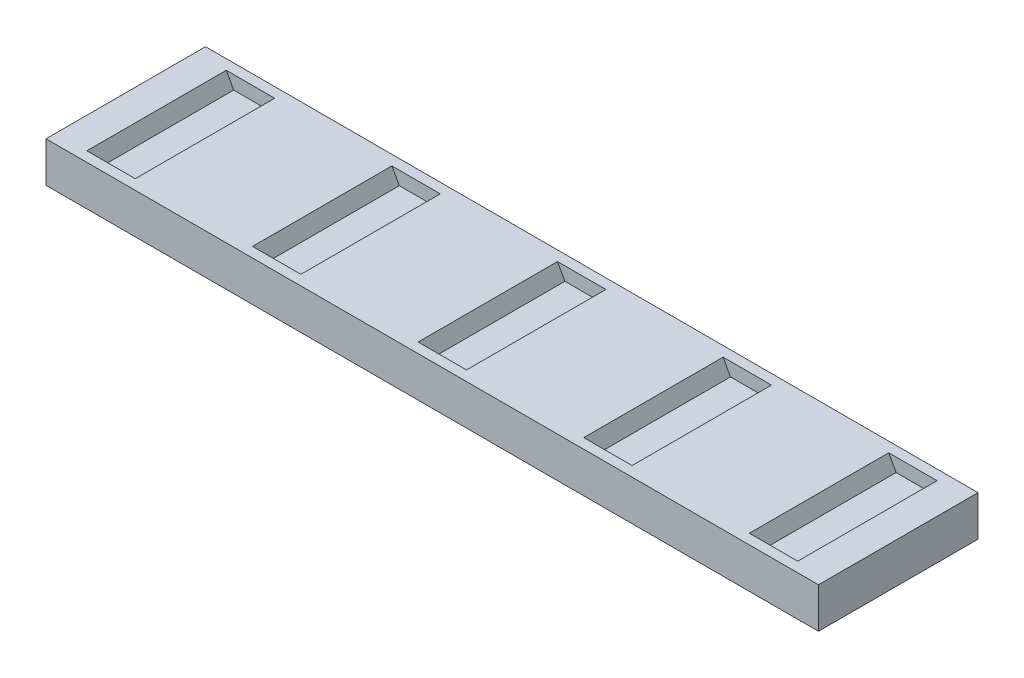
from build123d import *

# Parameters (mm, degrees)
EXTRUDE_1_DEPTH     = 19.2
SKETCH_9_W          = 230
SKETCH_9_H          = 17.5
SKETCH_9_R          = 2.1
EXTRUDE_2_DEPTH     = 3
SKETCH_13_W         = 230
SKETCH_13_H         = 16
SKETCH_13_R         = 2.1
EXTRUDE_3_DEPTH     = 1.55
SKETCH_14_W         = 230
SKETCH_14_H         = 47.5
SKETCH_14_R         = 2.1
EXTRUDE_4_DEPTH     = 3
SKETCH_15_W         = 208.313471068
SKETCH_15_H         = 9.29970853
EXTRUDE_5_DEPTH     = 47.5
SKETCH_16_W         = 230
SKETCH_16_H         = 33.21324475
EXTRUDE_6_DEPTH     = 3
SKETCH_18_W         = 230
SKETCH_18_H         = 20.5
EXTRUDE_7_DEPTH     = 44.5
SKETCH_19_W         = 230
SKETCH_19_H         = 8.5
CUT_EXTRUDE_1_DEPTH = 236.542459017
CUT_EXTRUDE_2_DEPTH = 20.75


with BuildPart() as part:
    # ｽｹｯﾁ5 → ﾎﾞｽ - 押し出し1 (new body)
    with BuildSketch(Plane.XY.offset(-1.55)):
        with BuildLine():
            Line((230, -2.976), (227.539284327, -2.976))
            ThreePointArc((227.539284327, -2.976), (226.75348461, -2.728238301), (226.251905437, -2.074567596))
            Line((226.251905437, -2.074567596), (225.496824583, 0))
            Line((225.496824583, 0), (219.003175417, 0))
            Line((219.003175417, 0), (218.248094563, -2.074567596))
            ThreePointArc((218.248094563, -2.074567596), (217.74651539, -2.728238301), (216.960715673, -2.976))
            Line((216.960715673, -2.976), (214.839284327, -2.976))
            ThreePointArc((214.839284327, -2.976), (214.05348461, -2.728238301), (213.551905437, -2.074567596))
            Line((213.551905437, -2.074567596), (212.796824583, 0))
            Line((212.796824583, 0), (206.303175417, 0))
            Line((206.303175417, 0), (205.548094563, -2.074567596))
            ThreePointArc((205.548094563, -2.074567596), (205.04651539, -2.728238301), (204.260715673, -2.976))
            Line((204.260715673, -2.976), (202.139284327, -2.976))
            ThreePointArc((202.139284327, -2.976), (201.35348461, -2.728238301), (200.851905437, -2.074567596))
            Line((200.851905437, -2.074567596), (200.096824583, 0))
            Line((200.096824583, 0), (193.603175417, 0))
            Line((193.603175417, 0), (192.848094563, -2.074567596))
            ThreePointArc((192.848094563, -2.074567596), (192.34651539, -2.728238301), (191.560715673, -2.976))
            Line((191.560715673, -2.976), (189.439284327, -2.976))
            ThreePointArc((189.439284327, -2.976), (188.65348461, -2.728238301), (188.151905437, -2.074567596))
            Line((188.151905437, -2.074567596), (187.396824583, 0))
            Line((187.396824583, 0), (180.903175417, 0))
            Line((180.903175417, 0), (180.148094563, -2.074567596))
            ThreePointArc((180.148094563, -2.074567596), (179.64651539, -2.728238301), (178.860715673, -2.976))
            Line((178.860715673, -2.976), (176.739284327, -2.976))
            ThreePointArc((176.739284327, -2.976), (175.95348461, -2.728238301), (175.451905437, -2.074567596))
            Line((175.451905437, -2.074567596), (174.696824583, 0))
            Line((174.696824583, 0), (168.203175417, 0))
            Line((168.203175417, 0), (167.448094563, -2.074567596))
            ThreePointArc((167.448094563, -2.074567596), (166.94651539, -2.728238301), (166.160715673, -2.976))
            Line((166.160715673, -2.976), (164.039284327, -2.976))
            ThreePointArc((164.039284327, -2.976), (163.25348461, -2.728238301), (162.751905437, -2.074567596))
            Line((162.751905437, -2.074567596), (161.996824583, 0))
            Line((161.996824583, 0), (155.503175417, 0))
            Line((155.503175417, 0), (154.748094563, -2.074567596))
            ThreePointArc((154.748094563, -2.074567596), (154.24651539, -2.728238301), (153.460715673, -2.976))
            Line((153.460715673, -2.976), (151.339284327, -2.976))
            ThreePointArc((151.339284327, -2.976), (150.55348461, -2.728238301), (150.051905437, -2.074567596))
            Line((150.051905437, -2.074567596), (149.296824583, 0))
            Line((149.296824583, 0), (142.803175417, 0))
            Line((142.803175417, 0), (142.048094563, -2.074567596))
            ThreePointArc((142.048094563, -2.074567596), (141.54651539, -2.728238301), (140.760715673, -2.976))
            Line((140.760715673, -2.976), (138.639284327, -2.976))
            ThreePointArc((138.639284327, -2.976), (137.85348461, -2.728238301), (137.351905437, -2.074567596))
            Line((137.351905437, -2.074567596), (136.596824583, 0))
            Line((136.596824583, 0), (130.103175417, 0))
            Line((130.103175417, 0), (129.348094563, -2.074567596))
            ThreePointArc((129.348094563, -2.074567596), (128.84651539, -2.728238301), (128.060715673, -2.976))
            Line((128.060715673, -2.976), (125.939284327, -2.976))
            ThreePointArc((125.939284327, -2.976), (125.15348461, -2.728238301), (124.651905437, -2.074567596))
            Line((124.651905437, -2.074567596), (123.896824583, 0))
            Line((123.896824583, 0), (117.403175417, 0))
            Line((117.403175417, 0), (116.648094563, -2.074567596))
            ThreePointArc((116.648094563, -2.074567596), (116.14651539, -2.728238301), (115.360715673, -2.976))
            Line((115.360715673, -2.976), (113.239284327, -2.976))
            ThreePointArc((113.239284327, -2.976), (112.45348461, -2.728238301), (111.951905437, -2.074567596))
            Line((111.951905437, -2.074567596), (111.196824583, 0))
            Line((111.196824583, 0), (104.703175417, 0))
            Line((104.703175417, 0), (103.948094563, -2.074567596))
            ThreePointArc((103.948094563, -2.074567596), (103.44651539, -2.728238301), (102.660715673, -2.976))
            Line((102.660715673, -2.976), (100.539284327, -2.976))
            ThreePointArc((100.539284327, -2.976), (99.75348461, -2.728238301), (99.251905437, -2.074567596))
            Line((99.251905437, -2.074567596), (98.496824583, 0))
            Line((98.496824583, 0), (92.003175417, 0))
            Line((92.003175417, 0), (91.248094563, -2.074567596))
            ThreePointArc((91.248094563, -2.074567596), (90.74651539, -2.728238301), (89.960715673, -2.976))
            Line((89.960715673, -2.976), (87.839284327, -2.976))
            ThreePointArc((87.839284327, -2.976), (87.05348461, -2.728238301), (86.551905437, -2.074567596))
            Line((86.551905437, -2.074567596), (85.796824583, 0))
            Line((85.796824583, 0), (79.303175417, 0))
            Line((79.303175417, 0), (78.548094563, -2.074567596))
            ThreePointArc((78.548094563, -2.074567596), (78.04651539, -2.728238301), (77.260715673, -2.976))
            Line((77.260715673, -2.976), (75.139284327, -2.976))
            ThreePointArc((75.139284327, -2.976), (74.35348461, -2.728238301), (73.851905437, -2.074567596))
            Line((73.851905437, -2.074567596), (73.096824583, 0))
            Line((73.096824583, 0), (66.603175417, 0))
            Line((66.603175417, 0), (65.848094563, -2.074567596))
            ThreePointArc((65.848094563, -2.074567596), (65.34651539, -2.728238301), (64.560715673, -2.976))
            Line((64.560715673, -2.976), (62.439284327, -2.976))
            ThreePointArc((62.439284327, -2.976), (61.65348461, -2.728238301), (61.151905437, -2.074567596))
            Line((61.151905437, -2.074567596), (60.396824583, 0))
            Line((60.396824583, 0), (53.903175417, 0))
            Line((53.903175417, 0), (53.148094563, -2.074567596))
            ThreePointArc((53.148094563, -2.074567596), (52.64651539, -2.728238301), (51.860715673, -2.976))
            Line((51.860715673, -2.976), (49.739284327, -2.976))
            ThreePointArc((49.739284327, -2.976), (48.95348461, -2.728238301), (48.451905437, -2.074567596))
            Line((48.451905437, -2.074567596), (47.696824583, 0))
            Line((47.696824583, 0), (41.203175417, 0))
            Line((41.203175417, 0), (40.448094563, -2.074567596))
            ThreePointArc((40.448094563, -2.074567596), (39.94651539, -2.728238301), (39.160715673, -2.976))
            Line((39.160715673, -2.976), (37.039284327, -2.976))
            ThreePointArc((37.039284327, -2.976), (36.25348461, -2.728238301), (35.751905437, -2.074567596))
            Line((35.751905437, -2.074567596), (34.996824583, 0))
            Line((34.996824583, 0), (28.503175417, 0))
            Line((28.503175417, 0), (27.748094563, -2.074567596))
            ThreePointArc((27.748094563, -2.074567596), (27.24651539, -2.728238301), (26.460715673, -2.976))
            Line((26.460715673, -2.976), (24.339284327, -2.976))
            ThreePointArc((24.339284327, -2.976), (23.55348461, -2.728238301), (23.051905437, -2.074567596))
            Line((23.051905437, -2.074567596), (22.296824583, 0))
            Line((22.296824583, 0), (15.803175417, 0))
            Line((15.803175417, 0), (15.048094563, -2.074567596))
            ThreePointArc((15.048094563, -2.074567596), (14.54651539, -2.728238301), (13.760715673, -2.976))
            Line((13.760715673, -2.976), (11.639284327, -2.976))
            ThreePointArc((11.639284327, -2.976), (10.85348461, -2.728238301), (10.351905437, -2.074567596))
            Line((10.351905437, -2.074567596), (9.596824583, 0))
            Line((9.596824583, 0), (3.103175417, 0))
            Line((3.103175417, 0), (2.348094563, -2.074567596))
            ThreePointArc((2.348094563, -2.074567596), (1.84651539, -2.728238301), (1.060715673, -2.976))
            Line((1.060715673, -2.976), (0, -2.976))
            Line((0, -2.976), (0, -15))
            Line((0, -15), (230, -15))
            Line((230, -15), (230, -2.976))
        make_face()
    extrude(amount=-EXTRUDE_1_DEPTH)


with BuildPart() as body_2:
    # ｽｹｯﾁ9 → ﾎﾞｽ - 押し出し2 (new body)
    with BuildSketch(Plane(origin=(0, 0, -20.75), x_dir=(-1, 0, 0), z_dir=(0, 0, -1))):
        with Locations((-115, -6.25)):
            Rectangle(SKETCH_9_W, SKETCH_9_H)
        with Locations((-25, -7)):
            Circle(SKETCH_9_R, mode=Mode.SUBTRACT)
        with Locations((-85, -7)):
            Circle(SKETCH_9_R, mode=Mode.SUBTRACT)
        with Locations(Location((-145, -7, 0), (0, 0, 180))):
            Circle(SKETCH_9_R, mode=Mode.SUBTRACT)
        with Locations(Location((-205, -7, 0), (0, 0, 180))):
            Circle(SKETCH_9_R, mode=Mode.SUBTRACT)
    extrude(amount=EXTRUDE_2_DEPTH)


with BuildPart() as body_3:
    # ｽｹｯﾁ13 → ﾎﾞｽ - 押し出し3 (new, symmetric)
    with BuildSketch(Plane.XY):
        with Locations((115, -7)):
            Rectangle(SKETCH_13_W, SKETCH_13_H)
        with Locations(Location((85, -7, 0), (0, 0, 180))):
            Circle(SKETCH_13_R, mode=Mode.SUBTRACT)
        with Locations(Location((25, -7, 0), (0, 0, 180))):
            Circle(SKETCH_13_R, mode=Mode.SUBTRACT)
        with Locations((205, -7)):
            Circle(SKETCH_13_R, mode=Mode.SUBTRACT)
        with Locations((145, -7)):
            Circle(SKETCH_13_R, mode=Mode.SUBTRACT)
    extrude(amount=EXTRUDE_3_DEPTH, both=True)


with BuildPart() as body_4:
    # ﾐﾗｰ1: mirrored copy
    add(part.part.mirror(Plane.XY))


with BuildPart() as body_5:
    # Mirror 1 2: mirrored copy
    add(body_2.part.mirror(Plane.XY))


with BuildPart() as body_6:
    # ｽｹｯﾁ14 → ﾎﾞｽ - 押し出し4 (new body)
    with BuildSketch(Plane.XZ.offset(15)):
        with Locations((115, 0)):
            Rectangle(SKETCH_14_W, SKETCH_14_H)
        with Locations(Location((7, 11.15, 0), (0, 0, 180))):
            Circle(SKETCH_14_R, mode=Mode.SUBTRACT)
        with Locations((121.5, -11.15)):
            Circle(SKETCH_14_R, mode=Mode.SUBTRACT)
        with Locations((223, -11.15)):
            Circle(SKETCH_14_R, mode=Mode.SUBTRACT)
        with Locations((7, -11.15)):
            Circle(SKETCH_14_R, mode=Mode.SUBTRACT)
        with Locations(Location((223, 11.15, 0), (0, 0, 180))):
            Circle(SKETCH_14_R, mode=Mode.SUBTRACT)
        with Locations(Location((121.5, 11.15, 0), (0, 0, 180))):
            Circle(SKETCH_14_R, mode=Mode.SUBTRACT)
    extrude(amount=EXTRUDE_4_DEPTH)


with BuildPart() as body_4_1:
    add(body_4.part)

    # Combine 2: union part, body 5, body 6, body 3, body 2
    add(part.part)
    add(body_5.part)
    add(body_6.part)
    add(body_3.part)
    add(body_2.part)

    # ｽｹｯﾁ15 → ﾎﾞｽ - 押し出し5 (add)
    with BuildSketch(Plane(origin=(0, 0, -23.75), x_dir=(-1, 0, 0), z_dir=(0, 0, -1))):
        with Locations((-110.084439777, -7.625854265)):
            Rectangle(SKETCH_15_W, SKETCH_15_H)
    extrude(amount=-EXTRUDE_5_DEPTH)

    # ｽｹｯﾁ16 → ﾎﾞｽ - 押し出し6 (add)
    with BuildSketch(Plane.XZ.offset(18)):
        with Locations((115, 1.195676811)):
            Rectangle(SKETCH_16_W, SKETCH_16_H)
    extrude(amount=-EXTRUDE_6_DEPTH)

    # ｽｹｯﾁ18 → ﾎﾞｽ - 押し出し7 (add)
    with BuildSketch(Plane.XY.offset(23.75)):
        with Locations((115, -7.75)):
            Rectangle(SKETCH_18_W, SKETCH_18_H)
    extrude(amount=-EXTRUDE_7_DEPTH)

    # ｽｹｯﾁ19 → ｶｯﾄ - 押し出し1 (cut, through all)
    with BuildSketch(Plane.XY.offset(23.75)):
        with Locations((115, -1.75)):
            Rectangle(SKETCH_19_W, SKETCH_19_H)
    extrude(amount=-CUT_EXTRUDE_1_DEPTH, mode=Mode.SUBTRACT)

    # ｽｹｯﾁ17 → ｶｯﾄ - 押し出し2 (cut, symmetric)
    with BuildSketch(Plane.XY):
        Polygon((5.88, 0), (26.88, 0), (21.38, -10), (11.38, -10), align=None)
        Polygon((55.19, 0), (76.19, 0), (70.69, -10), (60.69, -10), align=None)
        Polygon((104.5, 0), (125.5, 0), (120, -10), (110, -10), align=None)
        Polygon((153.81, 0), (174.81, 0), (169.31, -10), (159.31, -10), align=None)
        Polygon((203.12, 0), (224.12, 0), (218.62, -10), (208.62, -10), align=None)
    extrude(amount=CUT_EXTRUDE_2_DEPTH, both=True, mode=Mode.SUBTRACT)


solid = body_4_1.part
